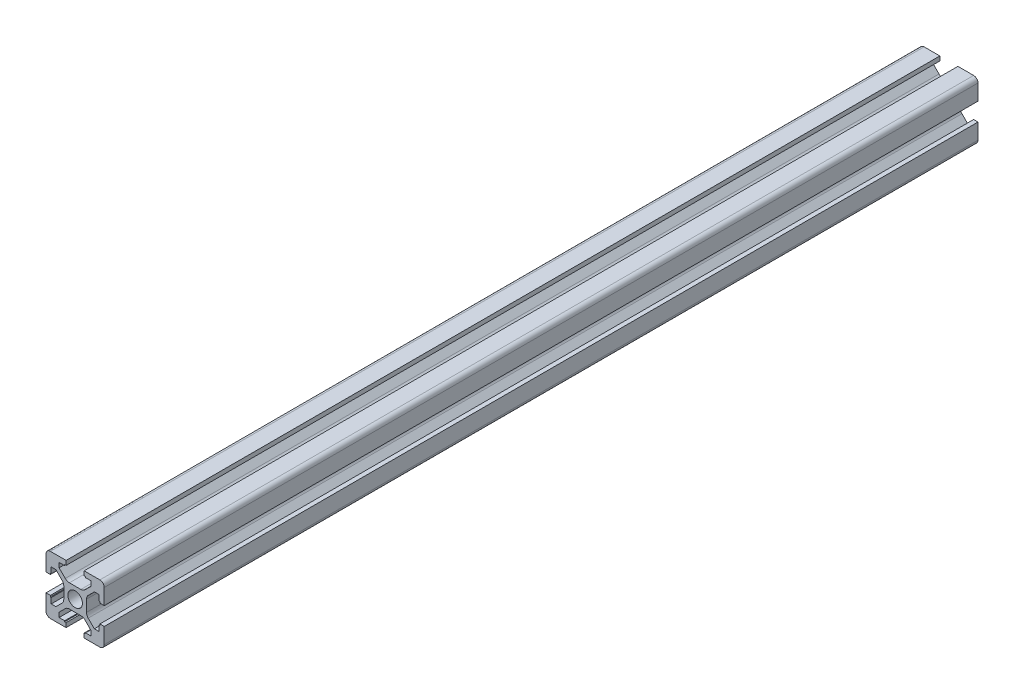
from build123d import *

# Parameters (mm, degrees)
SKETCH1_R           = 2.5
BOSS_EXTRUDE1_DEPTH = 300


with BuildPart() as part:
    # Sketch1 → Boss-Extrude1 (new body)
    with BuildSketch(Plane.XY):
        with BuildLine():
            Line((1.971572875, 3.9), (-1.971572875, 3.9))
            ThreePointArc((-1.971572875, 3.9), (-2.73693974, 4.052240935), (-3.385786438, 4.485786438))
            Line((-3.385786438, 4.485786438), (-5.5, 6.6))
            Line((-5.5, 6.6), (-5.5, 8.2))
            Line((-5.5, 8.2), (-3.6, 8.2))
            Line((-3.6, 8.2), (-3.6, 8.5))
            Line((-3.6, 8.5), (-3.1, 8.5))
            Line((-3.1, 8.5), (-3.1, 10))
            Line((-3.1, 10), (-8.5, 10))
            ThreePointArc((-8.5, 10), (-9.560660172, 9.560660172), (-10, 8.5))
            Line((-10, 8.5), (-10, 3.1))
            Line((-10, 3.1), (-8.5, 3.1))
            Line((-8.5, 3.1), (-8.5, 3.6))
            Line((-8.5, 3.6), (-8.2, 3.6))
            Line((-8.2, 3.6), (-8.2, 5.5))
            Line((-8.2, 5.5), (-6.6, 5.5))
            Line((-6.6, 5.5), (-4.485786438, 3.385786438))
            ThreePointArc((-4.485786438, 3.385786438), (-4.052240935, 2.73693974), (-3.9, 1.971572875))
            Line((-3.9, 1.971572875), (-3.9, -1.971572875))
            ThreePointArc((-3.9, -1.971572875), (-4.052240935, -2.73693974), (-4.485786438, -3.385786438))
            Line((-4.485786438, -3.385786438), (-6.6, -5.5))
            Line((-6.6, -5.5), (-8.2, -5.5))
            Line((-8.2, -5.5), (-8.2, -3.6))
            Line((-8.2, -3.6), (-8.5, -3.6))
            Line((-8.5, -3.6), (-8.5, -3.1))
            Line((-8.5, -3.1), (-10, -3.1))
            Line((-10, -3.1), (-10, -8.5))
            ThreePointArc((-10, -8.5), (-9.560660172, -9.560660172), (-8.5, -10))
            Line((-8.5, -10), (-3.1, -10))
            Line((-3.1, -10), (-3.1, -8.5))
            Line((-3.1, -8.5), (-3.6, -8.5))
            Line((-3.6, -8.5), (-3.6, -8.2))
            Line((-3.6, -8.2), (-5.5, -8.2))
            Line((-5.5, -8.2), (-5.5, -6.6))
            Line((-5.5, -6.6), (-3.385786438, -4.485786438))
            ThreePointArc((-3.385786438, -4.485786438), (-2.73693974, -4.052240935), (-1.971572875, -3.9))
            Line((-1.971572875, -3.9), (1.971572875, -3.9))
            ThreePointArc((1.971572875, -3.9), (2.73693974, -4.052240935), (3.385786438, -4.485786438))
            Line((3.385786438, -4.485786438), (5.5, -6.6))
            Line((5.5, -6.6), (5.5, -8.2))
            Line((5.5, -8.2), (3.6, -8.2))
            Line((3.6, -8.2), (3.6, -8.5))
            Line((3.6, -8.5), (3.1, -8.5))
            Line((3.1, -8.5), (3.1, -10))
            Line((3.1, -10), (8.5, -10))
            ThreePointArc((8.5, -10), (9.560660172, -9.560660172), (10, -8.5))
            Line((10, -8.5), (10, -3.1))
            Line((10, -3.1), (8.5, -3.1))
            Line((8.5, -3.1), (8.5, -3.6))
            Line((8.5, -3.6), (8.2, -3.6))
            Line((8.2, -3.6), (8.2, -5.5))
            Line((8.2, -5.5), (6.6, -5.5))
            Line((6.6, -5.5), (4.485786438, -3.385786438))
            ThreePointArc((4.485786438, -3.385786438), (4.052240935, -2.73693974), (3.9, -1.971572875))
            Line((3.9, -1.971572875), (3.9, 1.971572875))
            ThreePointArc((3.9, 1.971572875), (4.052240935, 2.73693974), (4.485786438, 3.385786438))
            Line((4.485786438, 3.385786438), (6.6, 5.5))
            Line((6.6, 5.5), (8.2, 5.5))
            Line((8.2, 5.5), (8.2, 3.6))
            Line((8.2, 3.6), (8.5, 3.6))
            Line((8.5, 3.6), (8.5, 3.1))
            Line((8.5, 3.1), (10, 3.1))
            Line((10, 3.1), (10, 8.5))
            ThreePointArc((10, 8.5), (9.560660172, 9.560660172), (8.5, 10))
            Line((8.5, 10), (3.1, 10))
            Line((3.1, 10), (3.1, 8.5))
            Line((3.1, 8.5), (3.6, 8.5))
            Line((3.6, 8.5), (3.6, 8.2))
            Line((3.6, 8.2), (5.5, 8.2))
            Line((5.5, 8.2), (5.5, 6.6))
            Line((5.5, 6.6), (3.385786438, 4.485786438))
            ThreePointArc((3.385786438, 4.485786438), (2.73693974, 4.052240935), (1.971572875, 3.9))
        make_face()
        Circle(SKETCH1_R, mode=Mode.SUBTRACT)
    extrude(amount=BOSS_EXTRUDE1_DEPTH)


solid = part.part
